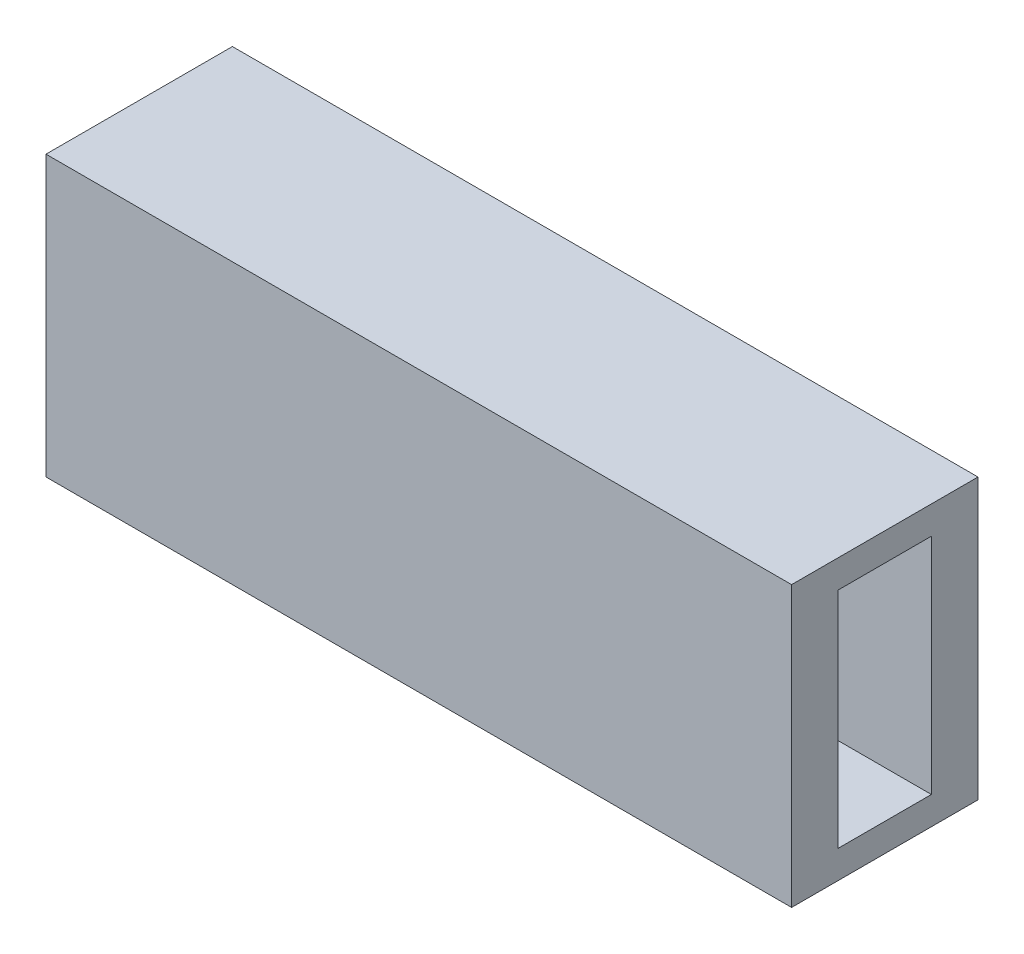
from build123d import *

# Parameters (mm, degrees)
SKETCH1_W           = 30
SKETCH1_H           = 45
SKETCH1_W_2         = 15
SKETCH1_H_2         = 36
BOSS_EXTRUDE1_DEPTH = 60


with BuildPart() as part:
    # Sketch1 → Boss-Extrude1 (new, symmetric)
    with BuildSketch(Plane(origin=(0, 0, 0), x_dir=(0, 0, -1), z_dir=(1, 0, 0))):
        Rectangle(SKETCH1_W, SKETCH1_H)
        Rectangle(SKETCH1_W_2, SKETCH1_H_2, mode=Mode.SUBTRACT)
    extrude(amount=BOSS_EXTRUDE1_DEPTH, both=True)


solid = part.part
